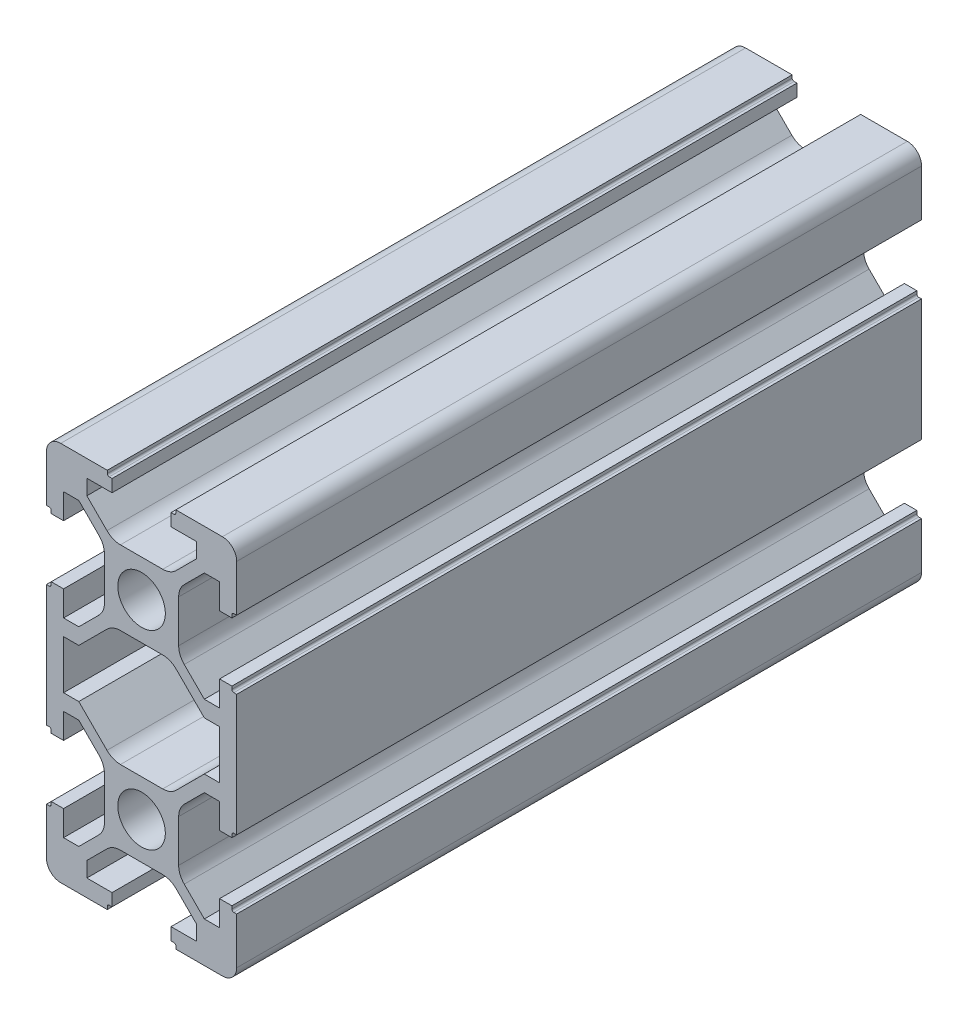
from build123d import *

# Parameters (mm, degrees)
CROQUIS3_R              = 2.5
SALIENTE_EXTRUIR3_DEPTH = 175
SKETCH1_W               = 4.862742591
SKETCH1_H               = 278
SKETCH1_W_2             = 1.5
SKETCH1_W_3             = 0.035786438
CUT_EXTRUDE3_DEPTH      = 100


with BuildPart() as part:
    # Croquis3 → Saliente-Extruir3 (new, symmetric)
    with BuildSketch(Plane.XY):
        with BuildLine():
            Line((-9.5, -13.101470971), (-9.5, -13.401470971))
            ThreePointArc((-9.5, -13.401470971), (-9.558578644, -13.542892327), (-9.7, -13.601470971))
            Line((-9.7, -13.601470971), (-10, -13.601470971))
            Line((-10, -13.601470971), (-10, -18.5))
            ThreePointArc((-10, -18.5), (-9.560660172, -19.560660172), (-8.5, -20))
            Line((-8.5, -20), (-3.601470971, -20))
            Line((-3.601470971, -20), (-3.601470971, -19.7))
            ThreePointArc((-3.601470971, -19.7), (-3.542892327, -19.558578644), (-3.401470971, -19.5))
            Line((-3.401470971, -19.5), (-3.101470971, -19.5))
            Line((-3.101470971, -19.5), (-3.101470971, -18.2))
            Line((-3.101470971, -18.2), (-5.751470971, -18.2))
            Line((-5.751470971, -18.2), (-5.751470971, -16.6))
            Line((-5.751470971, -16.6), (-3.637257409, -14.485786438))
            ThreePointArc((-3.637257409, -14.485786438), (-2.988410711, -14.052240935), (-2.223043846, -13.9))
            Line((-2.223043846, -13.9), (2.223043846, -13.9))
            ThreePointArc((2.223043846, -13.9), (2.988410711, -14.052240935), (3.637257409, -14.485786438))
            Line((3.637257409, -14.485786438), (5.751470971, -16.6))
            Line((5.751470971, -16.6), (5.751470971, -18.2))
            Line((5.751470971, -18.2), (3.101470971, -18.2))
            Line((3.101470971, -18.2), (3.101470971, -19.5))
            Line((3.101470971, -19.5), (3.401470971, -19.5))
            ThreePointArc((3.401470971, -19.5), (3.542892327, -19.558578644), (3.601470971, -19.7))
            Line((3.601470971, -19.7), (3.601470971, -20))
            Line((3.601470971, -20), (8.5, -20))
            ThreePointArc((8.5, -20), (9.560660172, -19.560660172), (10, -18.5))
            Line((10, -18.5), (10, -13.601470971))
            Line((10, -13.601470971), (9.7, -13.601470971))
            ThreePointArc((9.7, -13.601470971), (9.558578644, -13.542892327), (9.5, -13.401470971))
            Line((9.5, -13.401470971), (9.5, -13.101470971))
            Line((9.5, -13.101470971), (8.2, -13.101470971))
            Line((8.2, -13.101470971), (8.2, -15.751470971))
            Line((8.2, -15.751470971), (6.6, -15.751470971))
            Line((6.6, -15.751470971), (4.485786438, -13.637257409))
            ThreePointArc((4.485786438, -13.637257409), (4.052240935, -12.988410711), (3.9, -12.223043846))
            Line((3.9, -12.223043846), (3.9, -7.776956154))
            ThreePointArc((3.9, -7.776956154), (4.052507548, -7.010945946), (4.486771639, -6.361758076))
            Line((4.486771639, -6.361758076), (6.6, -4.251470971))
            Line((6.6, -4.251470971), (8.2, -4.251470971))
            Line((8.2, -4.251470971), (8.2, -6.901470971))
            Line((8.2, -6.901470971), (9.5, -6.901470971))
            Line((9.5, -6.901470971), (9.5, -6.601470971))
            ThreePointArc((9.5, -6.601470971), (9.558578644, -6.460049615), (9.7, -6.401470971))
            Line((9.7, -6.401470971), (10, -6.401470971))
            Line((10, -6.401470971), (10, 6.401470971))
            Line((10, 6.401470971), (9.7, 6.401470971))
            ThreePointArc((9.7, 6.401470971), (9.558578644, 6.460049615), (9.5, 6.601470971))
            Line((9.5, 6.601470971), (9.5, 6.901470971))
            Line((9.5, 6.901470971), (8.2, 6.901470971))
            Line((8.2, 6.901470971), (8.2, 4.251470971))
            Line((8.2, 4.251470971), (6.6, 4.251470971))
            Line((6.6, 4.251470971), (4.486771639, 6.361758076))
            ThreePointArc((4.486771639, 6.361758076), (4.052507548, 7.010945946), (3.9, 7.776956154))
            Line((3.9, 7.776956154), (3.9, 12.223043846))
            ThreePointArc((3.9, 12.223043846), (4.052240935, 12.988410711), (4.485786438, 13.637257409))
            Line((4.485786438, 13.637257409), (6.6, 15.751470971))
            Line((6.6, 15.751470971), (8.2, 15.751470971))
            Line((8.2, 15.751470971), (8.2, 13.101470971))
            Line((8.2, 13.101470971), (9.5, 13.101470971))
            Line((9.5, 13.101470971), (9.5, 13.401470971))
            ThreePointArc((9.5, 13.401470971), (9.558578644, 13.542892327), (9.7, 13.601470971))
            Line((9.7, 13.601470971), (10, 13.601470971))
            Line((10, 13.601470971), (10, 18.5))
            ThreePointArc((10, 18.5), (9.560660172, 19.560660172), (8.5, 20))
            Line((8.5, 20), (3.601470971, 20))
            Line((3.601470971, 20), (3.601470971, 19.7))
            ThreePointArc((3.601470971, 19.7), (3.542892327, 19.558578644), (3.401470971, 19.5))
            Line((3.401470971, 19.5), (3.101470971, 19.5))
            Line((3.101470971, 19.5), (3.101470971, 18.2))
            Line((3.101470971, 18.2), (5.751470971, 18.2))
            Line((5.751470971, 18.2), (5.751470971, 16.6))
            Line((5.751470971, 16.6), (3.637257409, 14.485786438))
            ThreePointArc((3.637257409, 14.485786438), (2.988410711, 14.052240935), (2.223043846, 13.9))
            Line((2.223043846, 13.9), (-2.223043846, 13.9))
            ThreePointArc((-2.223043846, 13.9), (-2.988410711, 14.052240935), (-3.637257409, 14.485786438))
            Line((-3.637257409, 14.485786438), (-5.751470971, 16.6))
            Line((-5.751470971, 16.6), (-5.751470971, 18.2))
            Line((-5.751470971, 18.2), (-3.101470971, 18.2))
            Line((-3.101470971, 18.2), (-3.101470971, 19.5))
            Line((-3.101470971, 19.5), (-3.401470971, 19.5))
            ThreePointArc((-3.401470971, 19.5), (-3.542892327, 19.558578644), (-3.601470971, 19.7))
            Line((-3.601470971, 19.7), (-3.601470971, 20))
            Line((-3.601470971, 20), (-8.5, 20))
            ThreePointArc((-8.5, 20), (-9.560660172, 19.560660172), (-10, 18.5))
            Line((-10, 18.5), (-10, 13.601470971))
            Line((-10, 13.601470971), (-9.7, 13.601470971))
            ThreePointArc((-9.7, 13.601470971), (-9.558578644, 13.542892327), (-9.5, 13.401470971))
            Line((-9.5, 13.401470971), (-9.5, 13.101470971))
            Line((-9.5, 13.101470971), (-8.2, 13.101470971))
            Line((-8.2, 13.101470971), (-8.2, 15.751470971))
            Line((-8.2, 15.751470971), (-6.6, 15.751470971))
            Line((-6.6, 15.751470971), (-4.485786438, 13.637257409))
            ThreePointArc((-4.485786438, 13.637257409), (-4.052240935, 12.988410711), (-3.9, 12.223043846))
            Line((-3.9, 12.223043846), (-3.9, 7.776956154))
            ThreePointArc((-3.9, 7.776956154), (-4.052507548, 7.010945946), (-4.486771639, 6.361758076))
            Line((-4.486771639, 6.361758076), (-6.6, 4.251470971))
            Line((-6.6, 4.251470971), (-8.2, 4.251470971))
            Line((-8.2, 4.251470971), (-8.2, 6.901470971))
            Line((-8.2, 6.901470971), (-9.5, 6.901470971))
            Line((-9.5, 6.901470971), (-9.5, 6.601470971))
            ThreePointArc((-9.5, 6.601470971), (-9.558578644, 6.460049615), (-9.7, 6.401470971))
            Line((-9.7, 6.401470971), (-10, 6.401470971))
            Line((-10, 6.401470971), (-10, -6.401470971))
            Line((-10, -6.401470971), (-9.7, -6.401470971))
            ThreePointArc((-9.7, -6.401470971), (-9.558578644, -6.460049615), (-9.5, -6.601470971))
            Line((-9.5, -6.601470971), (-9.5, -6.901470971))
            Line((-9.5, -6.901470971), (-8.2, -6.901470971))
            Line((-8.2, -6.901470971), (-8.2, -4.251470971))
            Line((-8.2, -4.251470971), (-6.6, -4.251470971))
            Line((-6.6, -4.251470971), (-4.486771639, -6.361758076))
            ThreePointArc((-4.486771639, -6.361758076), (-4.052507548, -7.010945946), (-3.9, -7.776956154))
            Line((-3.9, -7.776956154), (-3.9, -12.223043846))
            ThreePointArc((-3.9, -12.223043846), (-4.052240935, -12.988410711), (-4.485786438, -13.637257409))
            Line((-4.485786438, -13.637257409), (-6.6, -15.751470971))
            Line((-6.6, -15.751470971), (-8.2, -15.751470971))
            Line((-8.2, -15.751470971), (-8.2, -13.101470971))
            Line((-8.2, -13.101470971), (-9.5, -13.101470971))
        make_face()
        with Locations((0, -10)):
            Circle(CROQUIS3_R, mode=Mode.SUBTRACT)
        with Locations(Location((0, 10, 0), (0, 0, 180))):
            Circle(CROQUIS3_R, mode=Mode.SUBTRACT)
        with BuildLine():
            Line((-3.636272208, -5.515198077), (-6.6, -2.555595292))
            Line((-6.6, -2.555595292), (-8.2, -2.555595292))
            Line((-8.2, -2.555595292), (-8.2, 2.555595292))
            Line((-8.2, 2.555595292), (-6.6, 2.555595292))
            Line((-6.6, 2.555595292), (-3.636272208, 5.515198077))
            ThreePointArc((-3.636272208, 5.515198077), (-2.987767275, 5.948025454), (-2.223043846, 6.1))
            Line((-2.223043846, 6.1), (2.223043846, 6.1))
            ThreePointArc((2.223043846, 6.1), (2.987767275, 5.948025454), (3.636272208, 5.515198077))
            Line((3.636272208, 5.515198077), (6.6, 2.555595292))
            Line((6.6, 2.555595292), (8.2, 2.555595292))
            Line((8.2, 2.555595292), (8.2, -2.555595292))
            Line((8.2, -2.555595292), (6.6, -2.555595292))
            Line((6.6, -2.555595292), (3.636272208, -5.515198077))
            ThreePointArc((3.636272208, -5.515198077), (2.987767275, -5.948025454), (2.223043846, -6.1))
            Line((2.223043846, -6.1), (-2.223043846, -6.1))
            ThreePointArc((-2.223043846, -6.1), (-2.987767275, -5.948025454), (-3.636272208, -5.515198077))
        make_face(mode=Mode.SUBTRACT)
    extrude(amount=SALIENTE_EXTRUIR3_DEPTH, both=True)

    # Sketch1 → Cut-Extrude3 (cut)
    with BuildSketch(Plane(origin=(0, 20, 0), x_dir=(1, 0, 0), z_dir=(0, 1, 0))):
        Polygon((3.637257409, -175), (8.5, -175), (10, -175), (10, 103), (3.637257409, 103), align=None)
        Polygon((2.223043846, -175), (3.601470971, -175), (3.601470971, 103), (-3.601470971, 103), (-3.601470971, -175), (-2.223043846, -175), align=None)
        with Locations((-6.068628705, -36)):
            Rectangle(SKETCH1_W, SKETCH1_H)
        with Locations((-9.25, -36)):
            Rectangle(SKETCH1_W_2, SKETCH1_H)
        with Locations((-3.61936419, -36)):
            Rectangle(SKETCH1_W_3, SKETCH1_H)
        with Locations((3.61936419, -36)):
            Rectangle(SKETCH1_W_3, SKETCH1_H)
    extrude(amount=-CUT_EXTRUDE3_DEPTH, mode=Mode.SUBTRACT)


solid = part.part
